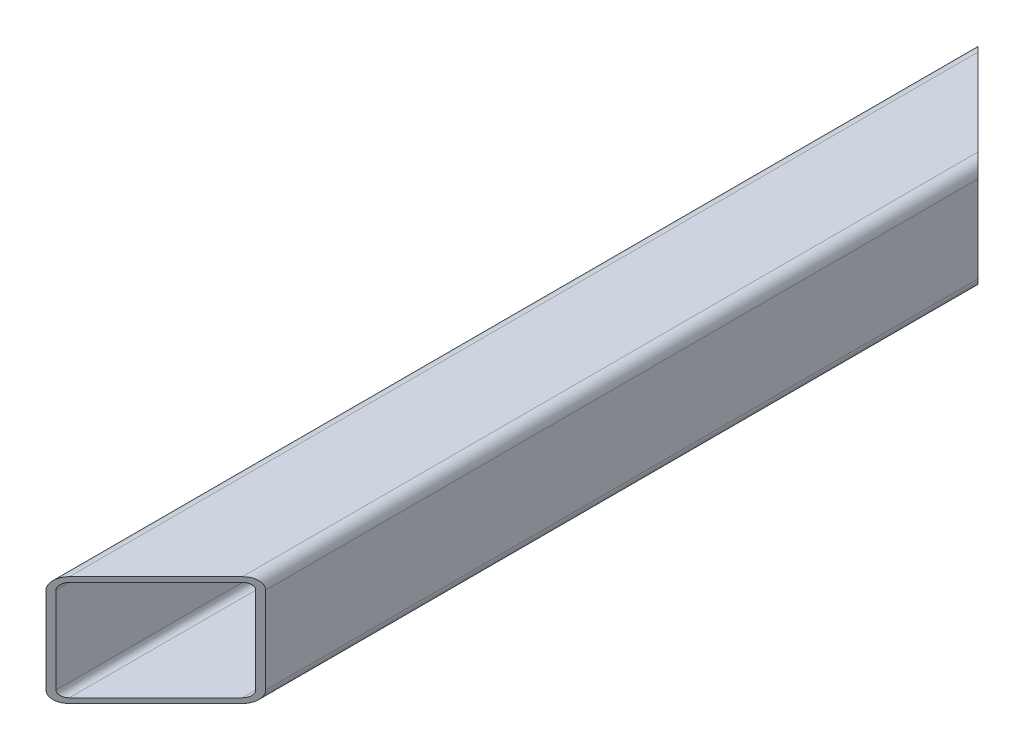
from build123d import *

# Parameters (mm, degrees)
EXTRUDE_1_DEPTH     = 280
CUT_EXTRUDE_1_DEPTH = 284.692174725


with BuildPart() as part:
    # Эскиз1 → Вытянуть-Тонкостенный1 (new body)
    with BuildSketch(Plane.XY):
        with BuildLine():
            Line((2, -1.5), (28, -1.5))
            ThreePointArc((28, -1.5), (30.474873734, -0.474873734), (31.5, 2))
            Line((31.5, 2), (31.5, 28))
            ThreePointArc((31.5, 28), (30.474873734, 30.474873734), (28, 31.5))
            Line((28, 31.5), (2, 31.5))
            ThreePointArc((2, 31.5), (-0.474873734, 30.474873734), (-1.5, 28))
            Line((-1.5, 28), (-1.5, 2))
            ThreePointArc((-1.5, 2), (-0.474873734, -0.474873734), (2, -1.5))
        make_face()
        with BuildLine():
            Line((2, 0), (28, 0))
            ThreePointArc((28, 0), (29.414213562, 0.585786438), (30, 2))
            Line((30, 2), (30, 28))
            ThreePointArc((30, 28), (29.414213562, 29.414213562), (28, 30))
            Line((28, 30), (2, 30))
            ThreePointArc((2, 30), (0.585786438, 29.414213562), (0, 28))
            Line((0, 28), (0, 2))
            ThreePointArc((0, 2), (0.585786438, 0.585786438), (2, 0))
        make_face(mode=Mode.SUBTRACT)
    extrude(amount=EXTRUDE_1_DEPTH)

    # Эскиз2 → Вырез-Вытянуть1 (cut, through all)
    with BuildSketch(Plane(origin=(0, 31.5, 0), x_dir=(1, 0, 0), z_dir=(0, 1, 0))):
        Polygon((-1.5, 0), (31.5, -33), (31.5, 0), align=None)
        Polygon((-1.5, -280), (31.5, -247), (31.5, -280), align=None)
    extrude(amount=-CUT_EXTRUDE_1_DEPTH, mode=Mode.SUBTRACT)


solid = part.part
